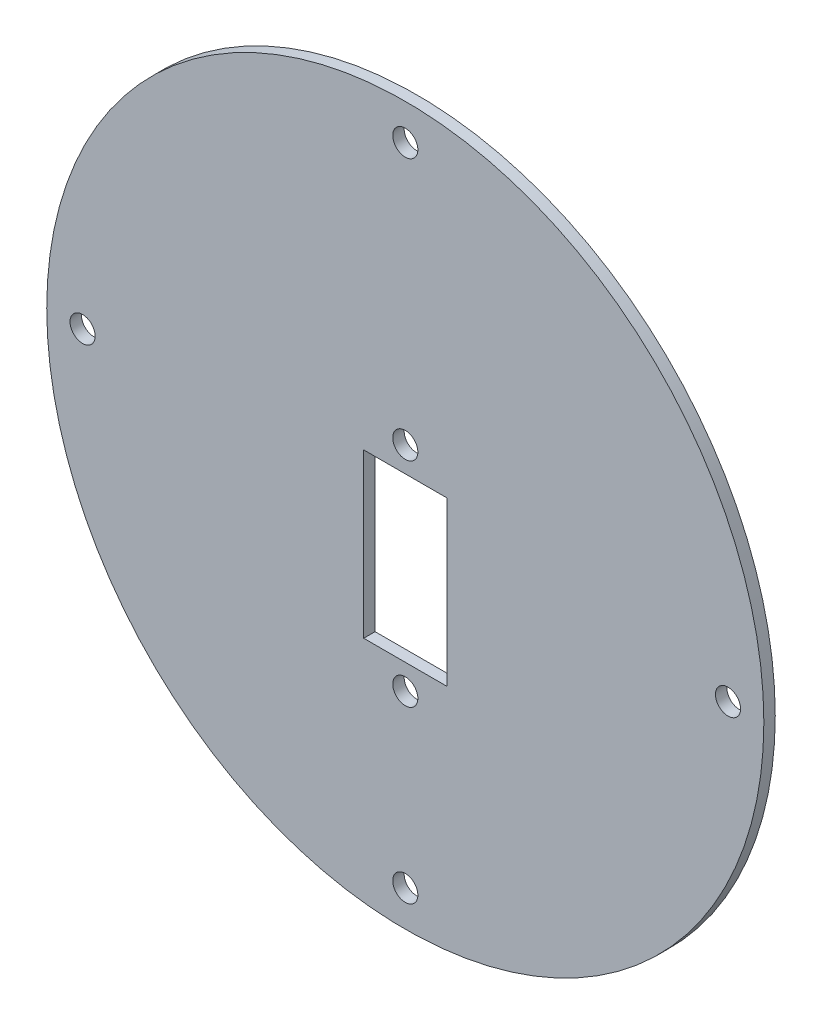
from build123d import *

# Parameters (mm, degrees)
SKETCH1_R           = 50
BOSS_EXTRUDE1_DEPTH = 1.59
SKETCH2_R           = 1.75
CUT_EXTRUDE1_DEPTH  = 1.59
SKETCH3_R           = 1.75
SKETCH3_W           = 11.6
SKETCH3_H           = 22.75
CUT_EXTRUDE2_DEPTH  = 10


with BuildPart() as part:
    # Sketch1 → Boss-Extrude1 (new body)
    with BuildSketch(Plane.XY):
        with Locations(Location((0, 0, 0), (0, 0, 180))):
            Circle(SKETCH1_R)
    extrude(amount=BOSS_EXTRUDE1_DEPTH)

    # Sketch2 → Cut-Extrude1 (cut)
    with BuildSketch(Plane.XY.offset(1.59)):
        with Locations((0, 45)):
            Circle(SKETCH2_R)
        with Locations((45, 0)):
            Circle(SKETCH2_R)
        with Locations((0, -45)):
            Circle(SKETCH2_R)
        with Locations((-45, 0)):
            Circle(SKETCH2_R)
    extrude(amount=-CUT_EXTRUDE1_DEPTH, mode=Mode.SUBTRACT)

    # Sketch3 → Cut-Extrude2 (cut)
    with BuildSketch(Plane.XY.offset(1.59)):
        with Locations((0, 8.5)):
            Circle(SKETCH3_R)
        with Locations((0, -21.25)):
            Circle(SKETCH3_R)
        with Locations((0, -6.375)):
            Rectangle(SKETCH3_W, SKETCH3_H)
    extrude(amount=-CUT_EXTRUDE2_DEPTH, mode=Mode.SUBTRACT)


solid = part.part
